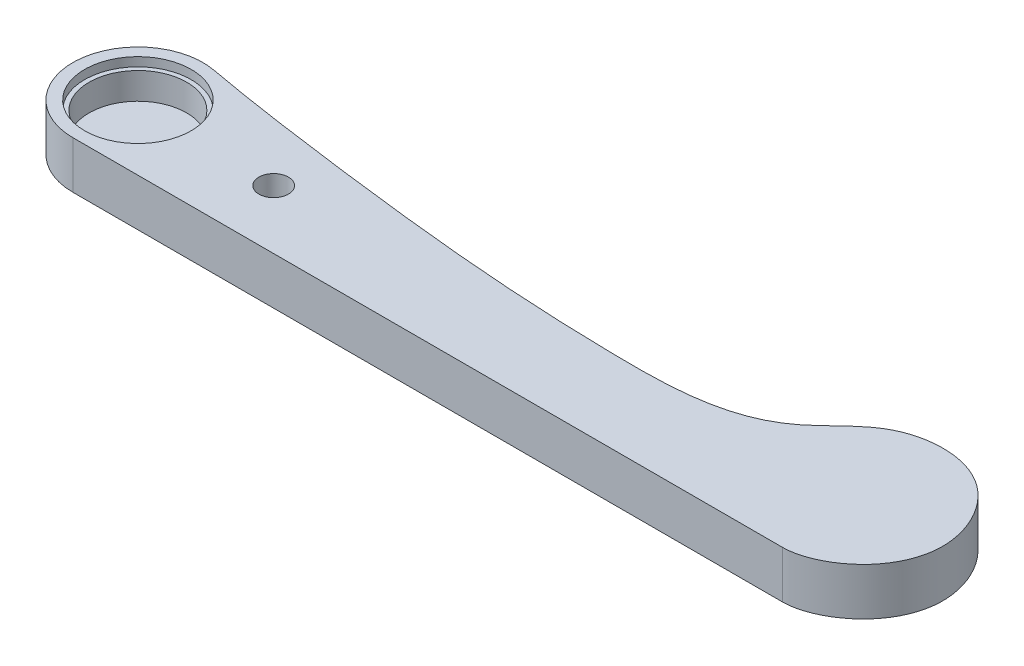
from build123d import *

# Parameters (mm, degrees)
BOSS_EXTRUDE1_DEPTH = 8
SKETCH2_R           = 9
CUT_EXTRUDE1_DEPTH  = 1.5
SKETCH3_R           = 8.25
CUT_EXTRUDE2_DEPTH  = 4.5
CUT_EXTRUDE3_REACH  = 136.693
SKETCH4_R           = 2.5


with BuildPart() as part:
    # Sketch1 → Boss-Extrude1 (new body)
    with BuildSketch(Plane(origin=(0, 0, 0), x_dir=(1, 0, 0), z_dir=(0, 1, 0))):
        with BuildLine():
            Line((0, -11), (120, -11))
            add(Edge.make_bspline(
                [(2.046502655, 10.807952021), (9.73590984, 9.351950718), (39.05187087, 5.229608851), (69.661948222, 2.532833548), (100.604507807, 3.167824251), (111.445141049, 17.475313366), (127.873824028, 17.948278541), (135.565165282, 3.470661398), (129.995145538, -7.674071777), (123.03041289, -11), (120, -11)],
                knots=[0, 0, 0, 0, 0.184804861, 0.47087127, 0.627246152, 0.696459643, 0.78506457, 0.878194343, 0.938782679, 1, 1, 1, 1], degree=3))
            ThreePointArc((2.046502655, 10.807952021), (-10.951882766, 1.027746995), (0, -11))
        make_face()
    extrude(amount=BOSS_EXTRUDE1_DEPTH)

    # Sketch2 → Cut-Extrude1 (cut)
    with BuildSketch(Plane(origin=(0, 8, 0), x_dir=(1, 0, 0), z_dir=(0, 1, 0))):
        with Locations(Location((0, 0, 0), (0, 0, 270))):
            Circle(SKETCH2_R)
    extrude(amount=-CUT_EXTRUDE1_DEPTH, mode=Mode.SUBTRACT)

    # Sketch3 → Cut-Extrude2 (cut)
    with BuildSketch(Plane(origin=(0, 6.5, 0), x_dir=(1, 0, 0), z_dir=(0, 1, 0))):
        with Locations(Location((0, 0, 0), (0, 0, 270))):
            Circle(SKETCH3_R)
    extrude(amount=-CUT_EXTRUDE2_DEPTH, mode=Mode.SUBTRACT)

    # Sketch4 → Cut-Extrude3 (cut, up to next)
    with BuildSketch(Plane.XZ, mode=Mode.PRIVATE) as cut_extrude3_sk1:
        with Locations(Location((24, 1.04786263, 0), (0, 0, 270))):
            Circle(SKETCH4_R)
    cut_extrude3_tool1 = extrude(cut_extrude3_sk1.sketch, amount=-CUT_EXTRUDE3_REACH, mode=Mode.PRIVATE) & part.part
    add(cut_extrude3_tool1.solids().sort_by_distance((24, 0, 1.047863))[0], mode=Mode.SUBTRACT)


solid = part.part
